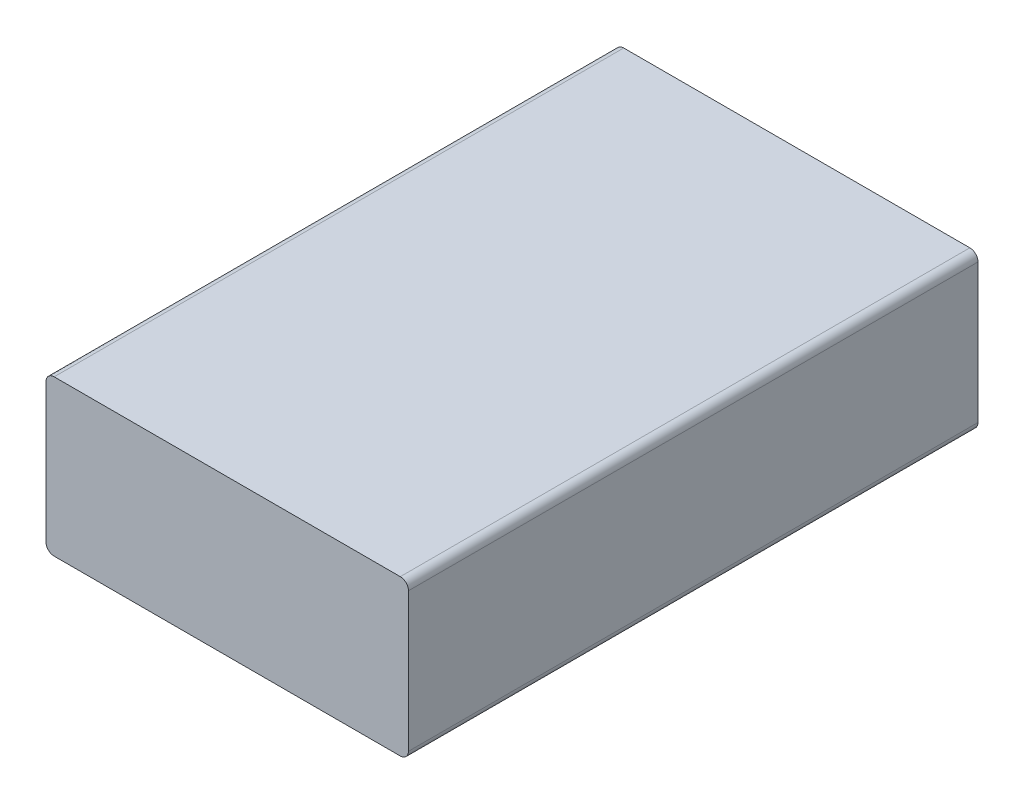
from build123d import *

# Parameters (mm, degrees)
SKETCH1_W           = 88.9
SKETCH1_H           = 38.1
BOSS_EXTRUDE1_DEPTH = 139.7
FILLET1_R           = 2


with BuildPart() as part:
    # Sketch1 → Boss-Extrude1 (new body)
    with BuildSketch(Plane.XY):
        Rectangle(SKETCH1_W, SKETCH1_H)
    extrude(amount=BOSS_EXTRUDE1_DEPTH)

    # Fillet1
    fillet1_edges = [part.edges().sort_by_distance(p)[0] for p in [
        (44.45, -19.05, 69.85),
        (-44.45, -19.05, 69.85),
        (-44.45, 19.05, 69.85),
        (44.45, 19.05, 69.85),
    ]]
    fillet(fillet1_edges, radius=FILLET1_R)


solid = part.part
